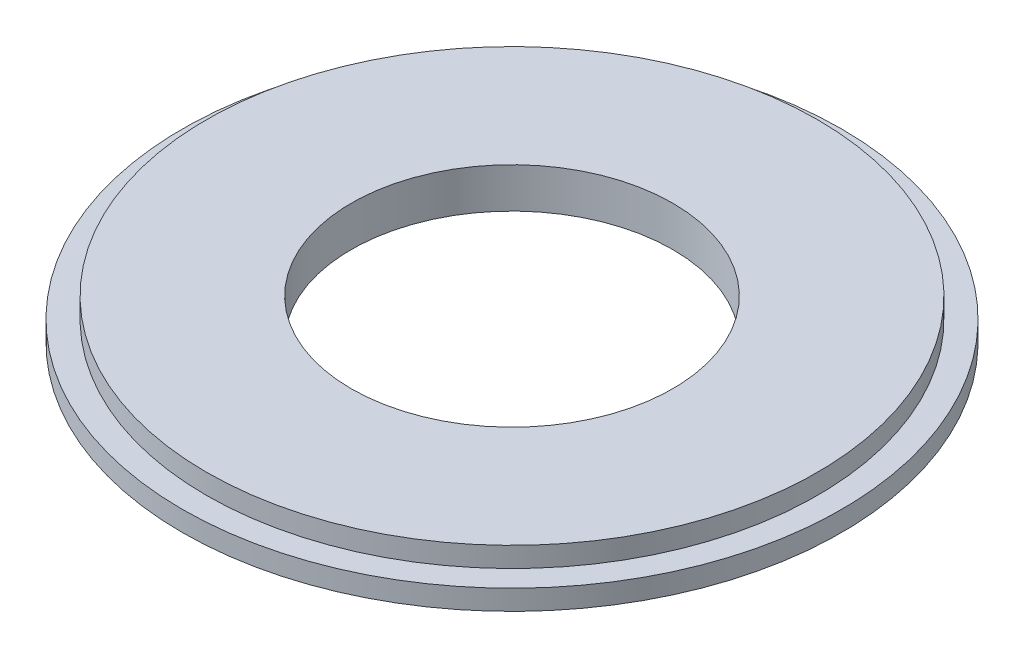
from build123d import *

# Parameters (mm, degrees)
SKETCH1_R           = 41
SKETCH1_R_2         = 20
BOSS_EXTRUDE1_DEPTH = 2.5
SKETCH3_R           = 38
SKETCH3_R_2         = 20
BOSS_EXTRUDE3_DEPTH = 2.5


with BuildPart() as part:
    # Sketch1 → Boss-Extrude1 (new body)
    with BuildSketch(Plane(origin=(0, 0, 0), x_dir=(1, 0, 0), z_dir=(0, 1, 0))):
        with Locations(Location((0, -0.015977487, 0), (0, 0, 270))):
            Circle(SKETCH1_R)
        with Locations(Location((0, -0.015977487, 0), (0, 0, 270))):
            Circle(SKETCH1_R_2, mode=Mode.SUBTRACT)
    extrude(amount=BOSS_EXTRUDE1_DEPTH)

    # Sketch3 → Boss-Extrude3 (add)
    with BuildSketch(Plane(origin=(0, 2.5, 0), x_dir=(1, 0, 0), z_dir=(0, 1, 0))):
        with Locations(Location((0, -0.015977487, 0), (0, 0, 270))):
            Circle(SKETCH3_R)
        with Locations(Location((0, -0.015977487, 0), (0, 0, 270))):
            Circle(SKETCH3_R_2, mode=Mode.SUBTRACT)
    extrude(amount=BOSS_EXTRUDE3_DEPTH)


solid = part.part
